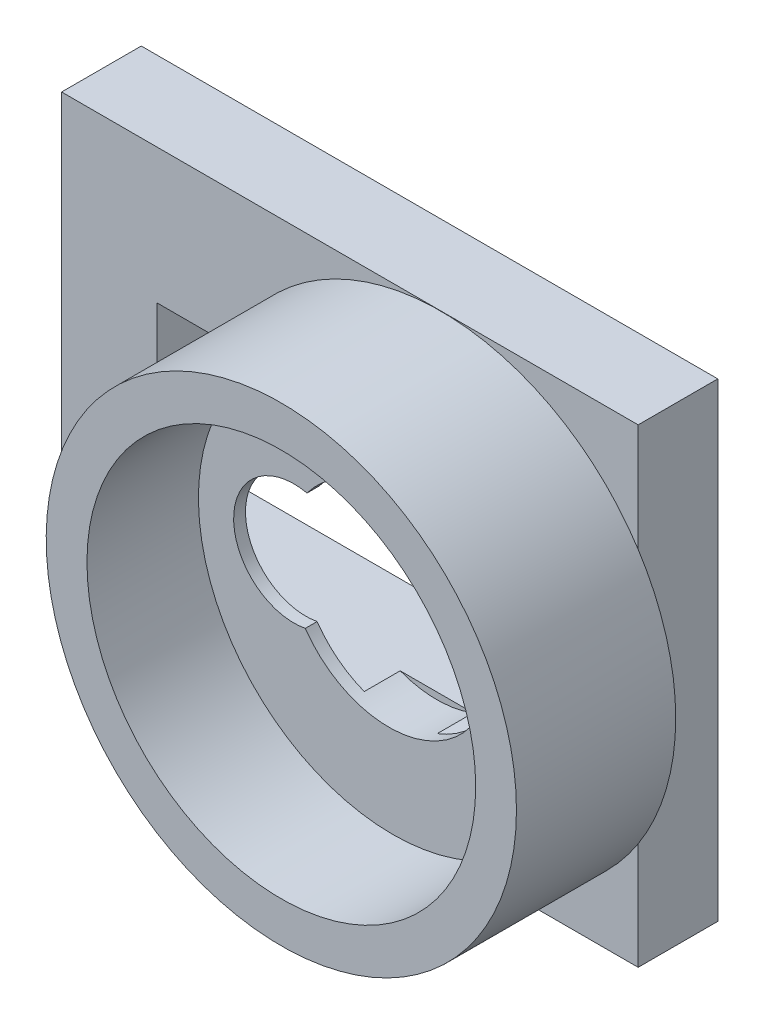
from build123d import *

# Parameters (mm, degrees)
ESQUISSE1_W             = 36.200001836
ESQUISSE1_H             = 29.499999305
BOSS_EXTRU_1_DEPTH      = 5
ESQUISSE2_W             = 33.052998595
ESQUISSE2_H             = 12.371999211
ENL_V_MAT_EXTRU_1_DEPTH = 5
BOSS_EXTRU_2_START      = 5
ESQUISSE3_W             = 4.558359629
ESQUISSE3_H             = 12.371999211
ESQUISSE3_W_2           = 4.999999888
ESQUISSE3_H_2           = 12.380001135
BOSS_EXTRU_2_DEPTH      = 3.5
BOSS_EXTRU_7_START      = 5
ESQUISSE5_R             = 14.763664953
ESQUISSE5_R_2           = 12.203597673
BOSS_EXTRU_7_DEPTH      = 10
BOSS_EXTRU_5_DEPTH      = 2
BOSS_EXTRU_5_DEPTH_BACK = 1
BOSS_EXTRU_5_START      = 6
ESQUISSE4_R             = 12.398139185
ENL_V_MAT_EXTRU_3_REACH = 53.128
ESQUISSE6_W             = 2.256513492
ESQUISSE6_H             = 12.371999211


with BuildPart() as part:
    # Esquisse1 → Boss.-Extru.1 (new body)
    with BuildSketch(Plane.XY):
        with Locations((5.10000065, -15.249999676)):
            Rectangle(ESQUISSE1_W, ESQUISSE1_H)
    extrude(amount=BOSS_EXTRU_1_DEPTH)

    # Esquisse2 → Enlèv. mat.-Extru.1 (cut)
    with BuildSketch(Plane.XY):
        with Locations((4.523499403, -15.158999246)):
            Rectangle(ESQUISSE2_W, ESQUISSE2_H)
    extrude(amount=ENL_V_MAT_EXTRU_1_DEPTH, mode=Mode.SUBTRACT)

    # Esquisse3 → Boss.-Extru.2 (add)
    with BuildSketch(Plane.XY.offset(BOSS_EXTRU_2_START)):
        with Locations((18.770818887, -15.158999246)):
            Rectangle(ESQUISSE3_W, ESQUISSE3_H)
        with Locations((-9.50299995, -15.163000208)):
            Rectangle(ESQUISSE3_W_2, ESQUISSE3_H_2)
    extrude(amount=-BOSS_EXTRU_2_DEPTH)

    # Esquisse5 → Boss.-Extru.7 (add)
    with BuildSketch(Plane.XY.offset(BOSS_EXTRU_7_START)):
        with Locations(Location((10.794645366, -15.275821527, 0), (0, 0, 204.273249948))):
            Circle(ESQUISSE5_R)
        with Locations(Location((10.794645366, -15.275821527, 0), (0, 0, 209.823305738))):
            Circle(ESQUISSE5_R_2, mode=Mode.SUBTRACT)
    extrude(amount=BOSS_EXTRU_7_DEPTH)

    # Esquisse4 → Boss.-Extru.5 (add, two sides: drawn at the far end of the back side and taken through both)
    with BuildSketch(Plane.XY.offset(BOSS_EXTRU_5_START - BOSS_EXTRU_5_DEPTH_BACK)):
        with Locations((10.5484362, -15.38812394)):
            Circle(ESQUISSE4_R)
        with BuildLine():
            ThreePointArc((5.299216058, -19.01722353), (16.929328279, -15.482422447), (5.408748548, -11.605494329))
            ThreePointArc((5.408748548, -11.605494329), (0.800592824, -15.244067738), (5.299216058, -19.01722353))
        make_face(mode=Mode.SUBTRACT)
    extrude(amount=BOSS_EXTRU_5_DEPTH + BOSS_EXTRU_5_DEPTH_BACK)

    # Enlèv. mat.-Extru.3: up to this face of the body (flat: up to its plane)
    enl_v_mat_extru_3_end = Plane(part.part.faces().sort_by_distance((16.491639072, -15.158999246, 3.25))[0])
    # Esquisse6 → Enlèv. mat.-Extru.3 (cut, up to the picked face)
    with BuildSketch(Plane.ZY.offset(13.000000268), mode=Mode.PRIVATE) as enl_v_mat_extru_3_sk1:
        with Locations((6.128256634, -15.158999246)):
            Rectangle(ESQUISSE6_W, ESQUISSE6_H)
    enl_v_mat_extru_3_tool1 = split(extrude(enl_v_mat_extru_3_sk1.sketch, amount=-ENL_V_MAT_EXTRU_3_REACH, mode=Mode.PRIVATE), bisect_by=enl_v_mat_extru_3_end, keep=Keep.BOTH, mode=Mode.PRIVATE)
    add(enl_v_mat_extru_3_tool1.solids().sort_by(Axis((-13, -15.158999, 6.128257), (1, 0, 0)))[0], mode=Mode.SUBTRACT)


solid = part.part
